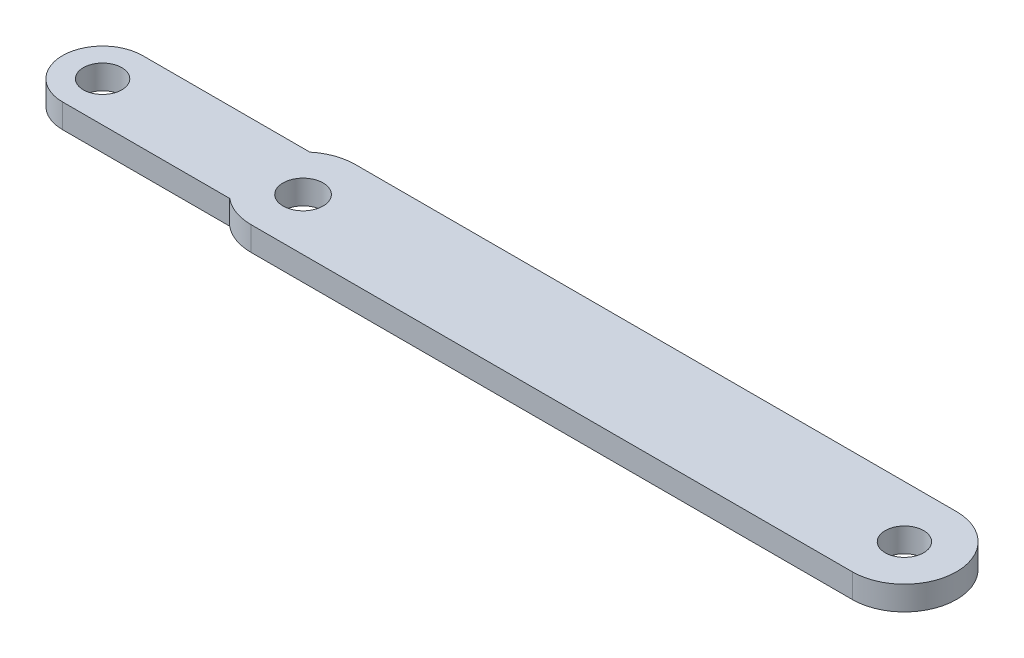
from build123d import *

# Parameters (mm, degrees)
SKETCH2_R           = 2.5
SKETCH2_R_2         = 2.4
BOSS_EXTRUDE1_DEPTH = 3


with BuildPart() as part:
    # Sketch2 → Boss-Extrude1 (new body)
    with BuildSketch(Plane(origin=(0, 0, 0), x_dir=(1, 0, 0), z_dir=(0, 1, 0))):
        with BuildLine():
            Line((87.593623105, 198.818492307), (12.593623105, 198.818492307))
            ThreePointArc((12.593623105, 198.818492307), (10.385682888, 198.432001937), (8.440311173, 197.318492307))
            Line((8.440311173, 197.318492307), (-12.406376895, 197.318492307))
            ThreePointArc((-12.406376895, 197.318492307), (-17.406376895, 192.318492307), (-12.406376895, 187.318492307))
            Line((-12.406376895, 187.318492307), (8.440311173, 187.318492307))
            ThreePointArc((8.440311173, 187.318492307), (10.385682888, 186.204982677), (12.593623105, 185.818492307))
            Line((12.593623105, 185.818492307), (87.593623105, 185.818492307))
            ThreePointArc((87.593623105, 185.818492307), (94.093623105, 192.318492307), (87.593623105, 198.818492307))
        make_face()
        with Locations(Location((12.593623105, 192.318492307, 0), (0, 0, 270))):
            Circle(SKETCH2_R, mode=Mode.SUBTRACT)
        with Locations(Location((87.593623105, 192.318492307, 0), (0, 0, 270))):
            Circle(SKETCH2_R_2, mode=Mode.SUBTRACT)
        with Locations(Location((-12.406376895, 192.318492307, 0), (0, 0, 270))):
            Circle(SKETCH2_R_2, mode=Mode.SUBTRACT)
    extrude(amount=BOSS_EXTRUDE1_DEPTH)


solid = part.part
